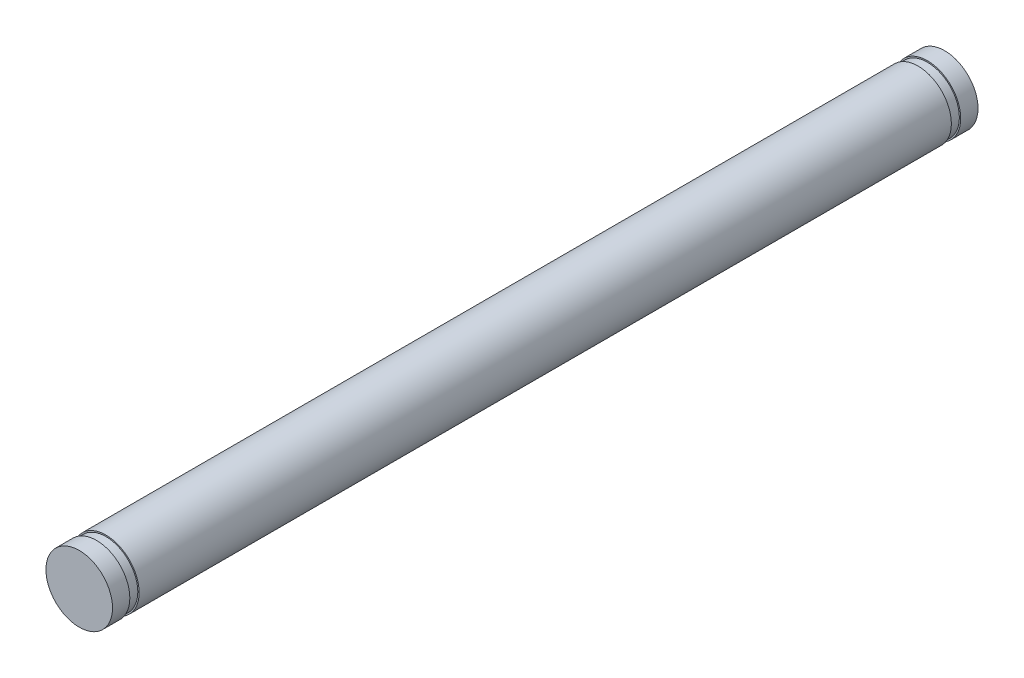
from build123d import *


with BuildPart() as part:
    # Szkic1 → Obrót1 (revolve)
    with BuildSketch(Plane(origin=(0, 0, 0), x_dir=(0, 0, -1), z_dir=(1, 0, 0)), mode=Mode.PRIVATE) as obr_t1_sk:
        Polygon((-31.2, -2.5), (-31.2, -2.4), (-30.5, -2.4), (-30.5, -2.5), (30.5, -2.5), (30.5, -2.4), (31.2, -2.4), (31.2, -2.5), (32.5, -2.5), (32.5, 0), (-32.5, 0), (-32.5, -2.5), align=None)
    revolve(obr_t1_sk.sketch.rotate(Axis((0, 0, 32.5), (0, 0, -1)), 270), axis=Axis((0, 0, 32.5), (0, 0, -1)))


solid = part.part
